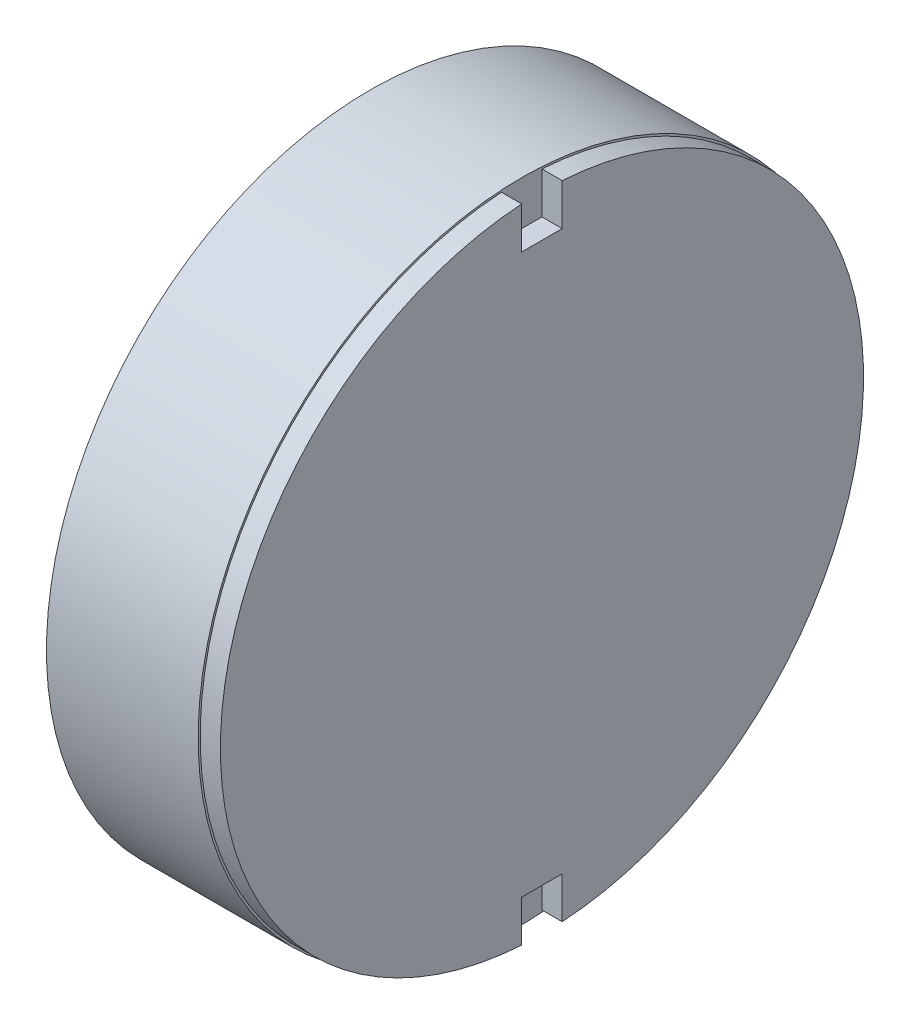
from build123d import *

# Parameters (mm, degrees)
SKETCH1_R           = 16
BOSS_EXTRUDE1_DEPTH = 8.5
SKETCH2_W           = 1
SKETCH2_H           = 0.1
CUT_EXTRUDE1_DEPTH  = 1


with BuildPart() as part:
    # Sketch1 → Boss-Extrude1 (new body)
    with BuildSketch(Plane(origin=(0, 0, 0), x_dir=(0, 0, -1), z_dir=(1, 0, 0))):
        Circle(SKETCH1_R)
    extrude(amount=BOSS_EXTRUDE1_DEPTH)

    # Sketch2 → Cut-Revolve1 (revolve, cut)
    with BuildSketch(Plane.XY, mode=Mode.PRIVATE) as cut_revolve1_sk:
        with Locations((8, 15.95)):
            Rectangle(SKETCH2_W, SKETCH2_H)
    revolve(cut_revolve1_sk.sketch.rotate(Axis((8.5, 0, 0), (-1, 0, 0)), 90), axis=Axis((8.5, 0, 0), (-1, 0, 0)), mode=Mode.SUBTRACT)

    # Sketch3 → Cut-Extrude1 (cut)
    with BuildSketch(Plane(origin=(8.5, 0, 0), x_dir=(0, 0, -1), z_dir=(1, 0, 0))):
        Polygon((-1, 15.814143289), (-1, 17.814143289), (1, 17.814143289), (1, 15.814143289), (1, 13.814143289), (-1, 13.814143289), align=None)
        Polygon((1, -17.814143289), (1, -15.814143289), (1, -13.814143289), (-1, -13.814143289), (-1, -15.814143289), (-1, -17.814143289), align=None)
    extrude(amount=-CUT_EXTRUDE1_DEPTH, mode=Mode.SUBTRACT)


solid = part.part
